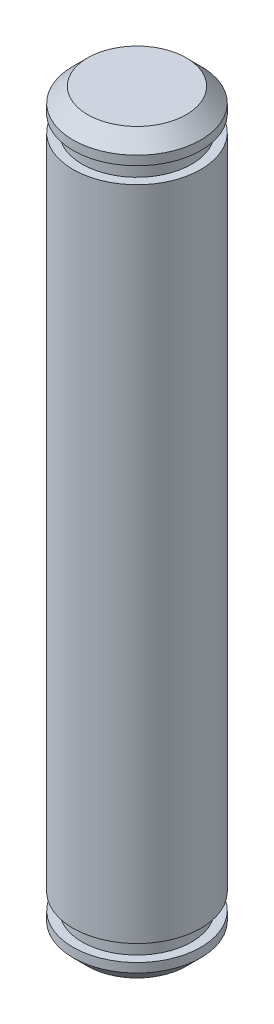
from build123d import *


with BuildPart() as part:
    # Esquisse1 → Base-Révolution (revolve)
    with BuildSketch(Plane(origin=(0, 0, 0), x_dir=(-0.25533200274967977, 0, -0.9668534368619877), z_dir=(0.9668534368619877, 0, -0.25533200274967977))):
        Polygon((-3.5, 18), (-3.5, -18), (-3, -18), (-3, -18.9), (-3.5, -18.9), (-3.5, -19.4), (-2.7, -20.2), (0, -20.2), (0, 20.2), (-2.7, 20.2), (-3.5, 19.4), (-3.5, 18.9), (-3, 18.9), (-3, 18), align=None)
    revolve(axis=Axis((0, 0, 0), (0, -1, 0)))


solid = part.part
